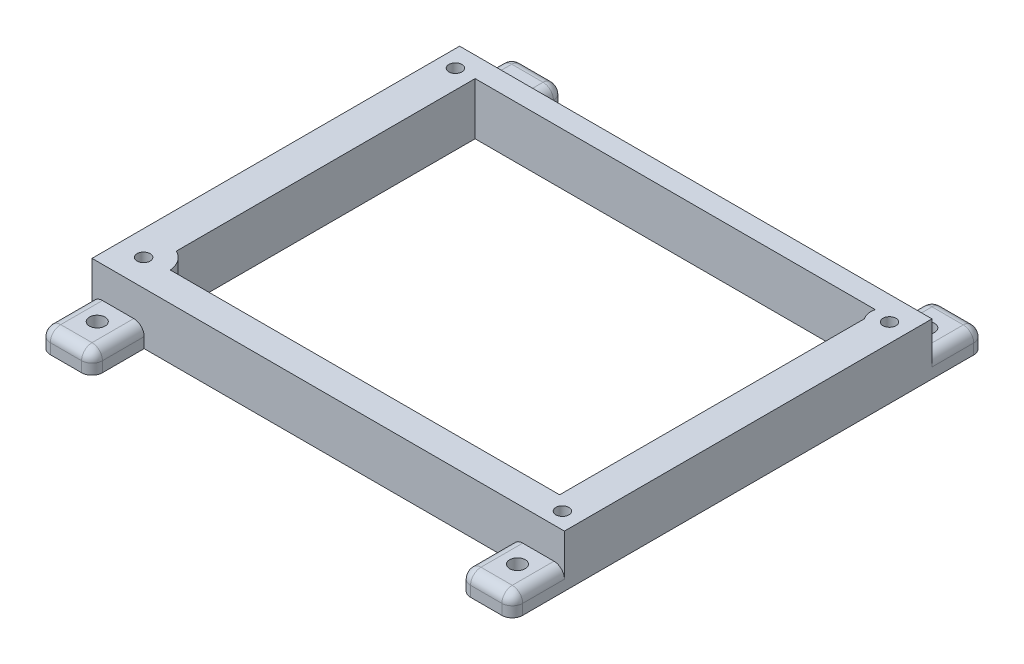
from build123d import *

# Parameters (mm, degrees)
SKETCH1_W           = 90.58
SKETCH1_H           = 70.48
SKETCH1_R           = 1.25
BOSS_EXTRUDE1_DEPTH = 10
SKETCH2_W           = 10
SKETCH2_H           = 4
BOSS_EXTRUDE2_DEPTH = 10
SKETCH3_W           = 10
SKETCH3_H           = 4
BOSS_EXTRUDE3_DEPTH = 10
FILLET2_R           = 2
FILLET3_R           = 2
CUT_EXTRUDE1_REACH  = 123.317
SKETCH4_R           = 1.5


with BuildPart() as part:
    # Sketch1 → Boss-Extrude1 (new body)
    with BuildSketch(Plane(origin=(0, 0, 0), x_dir=(1, 0, 0), z_dir=(0, 1, 0))):
        with Locations((-45.29, -35.24)):
            Rectangle(SKETCH1_W, SKETCH1_H)
        with Locations(Location((-3.505, -67.355, 0), (0, 0, 270))):
            Circle(SKETCH1_R, mode=Mode.SUBTRACT)
        with BuildLine():
            Line((-83.7, -61.178989341), (-83.7, -3.9))
            Line((-83.7, -3.9), (-6.990565569, -3.9))
            ThreePointArc((-6.990565569, -3.9), (-6.996312077, -5.25078698), (-6.49, -6.503107452))
            Line((-6.49, -6.503107452), (-6.49, -64.91))
            Line((-6.49, -64.91), (-81.134920114, -64.91))
            ThreePointArc((-81.134920114, -64.91), (-81.937140101, -62.714273406), (-83.7, -61.178989341))
        make_face(mode=Mode.SUBTRACT)
        with Locations(Location((-87.32, -4.06, 0), (0, 0, 270))):
            Circle(SKETCH1_R, mode=Mode.SUBTRACT)
        with Locations(Location((-3.56, -4.59, 0), (0, 0, 270))):
            Circle(SKETCH1_R, mode=Mode.SUBTRACT)
        with Locations(Location((-85.8, -65.37, 0), (0, 0, 270))):
            Circle(SKETCH1_R, mode=Mode.SUBTRACT)
    extrude(amount=-BOSS_EXTRUDE1_DEPTH)

    # Sketch2 → Boss-Extrude2 (add)
    with BuildSketch(Plane.XY.offset(70.48)):
        with Locations((-85.58, -8)):
            Rectangle(SKETCH2_W, SKETCH2_H)
        with Locations((-5, -8)):
            Rectangle(SKETCH2_W, SKETCH2_H)
    extrude(amount=BOSS_EXTRUDE2_DEPTH)

    # Sketch3 → Boss-Extrude3 (add)
    with BuildSketch(Plane(origin=(0, 0, 0), x_dir=(-1, 0, 0), z_dir=(0, 0, -1))):
        with Locations((5, -8)):
            Rectangle(SKETCH3_W, SKETCH3_H)
        with Locations((85.58, -8)):
            Rectangle(SKETCH3_W, SKETCH3_H)
    extrude(amount=BOSS_EXTRUDE3_DEPTH)

    # Fillet2
    fillet2_edges = [part.edges().sort_by_distance(p)[0] for p in [
        (-90.58, -8, 80.48),
        (-80.58, -8, 80.48),
        (0, -8, 80.48),
        (-10, -8, 80.48),
        (0, -8, -10),
        (-10, -8, -10),
        (-90.58, -8, -10),
        (-80.58, -8, -10),
    ]]
    fillet(fillet2_edges, radius=FILLET2_R)

    # Fillet3
    fillet3_edges = [part.edges().sort_by_distance(p)[0] for p in [
        (-85.58, -6, 80.48),
        (-90.58, -6, 74.48),
        (-80.58, -6, 74.48),
        (-89.994213562, -6, 79.894213562),
        (-81.165786438, -6, 79.894213562),
        (-90.58, -6, -4),
        (-85.58, -6, -10),
        (-80.58, -6, -4),
        (-81.165786438, -6, -9.414213562),
        (-89.994213562, -6, -9.414213562),
        (-5, -6, -10),
        (-10, -6, -4),
        (-9.414213562, -6, -9.414213562),
        (-0.585786438, -6, -9.414213562),
        (-5, -6, 80.48),
        (-10, -6, 74.48),
        (0, -6, 74.48),
        (-9.414213562, -6, 79.894213562),
        (-0.585786438, -6, 79.894213562),
        (0, -6, -4),
    ]]
    fillet(fillet3_edges, radius=FILLET3_R)

    # Sketch4 → Cut-Extrude1 (cut, up to next)
    with BuildSketch(Plane(origin=(0, -6, 0), x_dir=(1, 0, 0), z_dir=(0, 1, 0)), mode=Mode.PRIVATE) as cut_extrude1_sk1:
        with Locations(Location((-5, 4, 0), (0, 0, 270))):
            Circle(SKETCH4_R)
    cut_extrude1_tool1 = extrude(cut_extrude1_sk1.sketch, amount=-CUT_EXTRUDE1_REACH, mode=Mode.PRIVATE) & part.part
    # Sketch4 → Cut-Extrude1 (cut, up to next)
    with BuildSketch(Plane(origin=(0, -6, 0), x_dir=(1, 0, 0), z_dir=(0, 1, 0)), mode=Mode.PRIVATE) as cut_extrude1_sk2:
        with Locations(Location((-5, -74.48, 0), (0, 0, 270))):
            Circle(SKETCH4_R)
    cut_extrude1_tool2 = extrude(cut_extrude1_sk2.sketch, amount=-CUT_EXTRUDE1_REACH, mode=Mode.PRIVATE) & part.part
    # Sketch4 → Cut-Extrude1 (cut, up to next)
    with BuildSketch(Plane(origin=(0, -6, 0), x_dir=(1, 0, 0), z_dir=(0, 1, 0)), mode=Mode.PRIVATE) as cut_extrude1_sk3:
        with Locations(Location((-85.58, -74.48, 0), (0, 0, 270))):
            Circle(SKETCH4_R)
    cut_extrude1_tool3 = extrude(cut_extrude1_sk3.sketch, amount=-CUT_EXTRUDE1_REACH, mode=Mode.PRIVATE) & part.part
    # Sketch4 → Cut-Extrude1 (cut, up to next)
    with BuildSketch(Plane(origin=(0, -6, 0), x_dir=(1, 0, 0), z_dir=(0, 1, 0)), mode=Mode.PRIVATE) as cut_extrude1_sk4:
        with Locations(Location((-85.58, 4, 0), (0, 0, 270))):
            Circle(SKETCH4_R)
    cut_extrude1_tool4 = extrude(cut_extrude1_sk4.sketch, amount=-CUT_EXTRUDE1_REACH, mode=Mode.PRIVATE) & part.part
    add(cut_extrude1_tool1.solids().sort_by_distance((-5, -6, -4))[0], mode=Mode.SUBTRACT)
    add(cut_extrude1_tool2.solids().sort_by_distance((-5, -6, 74.48))[0], mode=Mode.SUBTRACT)
    add(cut_extrude1_tool3.solids().sort_by_distance((-85.58, -6, 74.48))[0], mode=Mode.SUBTRACT)
    add(cut_extrude1_tool4.solids().sort_by_distance((-85.58, -6, -4))[0], mode=Mode.SUBTRACT)


solid = part.part
